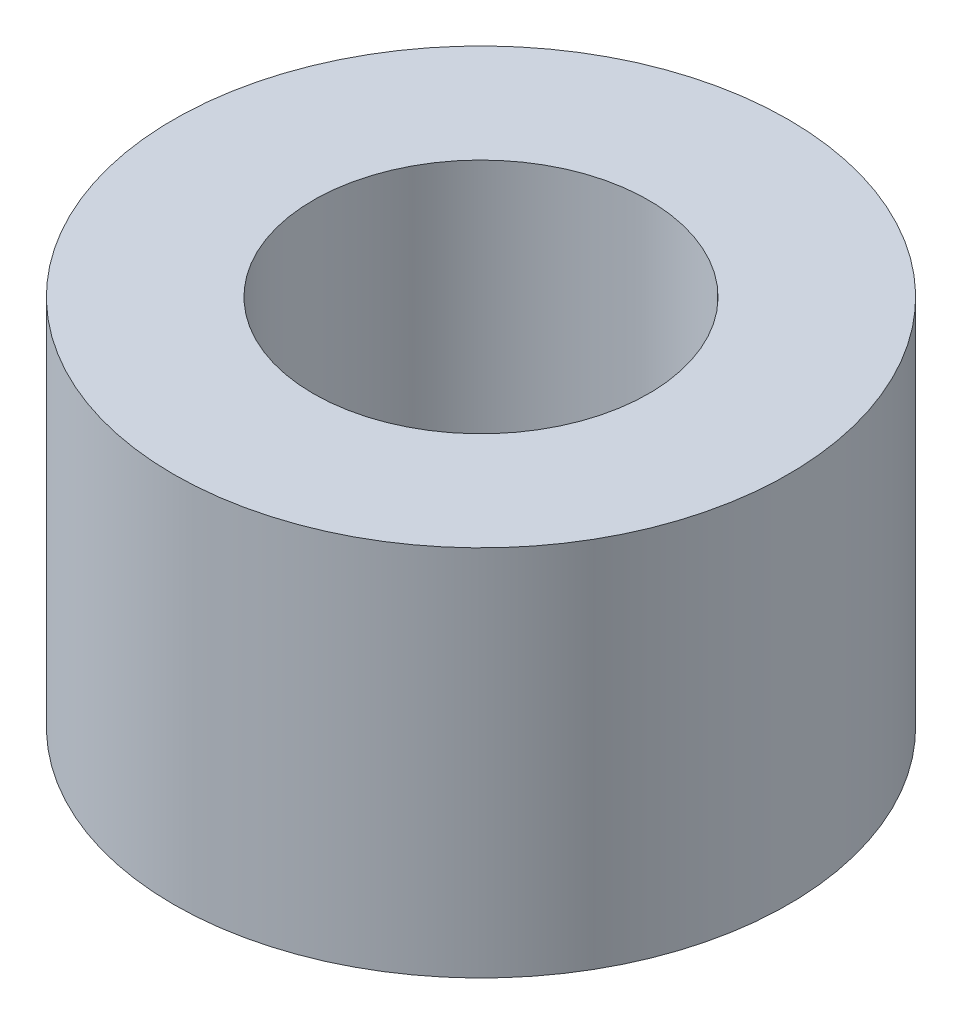
from build123d import *

# Parameters (mm, degrees)
SKETCH1_R           = 3.3
SKETCH1_R_2         = 1.8
BOSS_EXTRUDE1_DEPTH = 4


with BuildPart() as part:
    # Sketch1 → Boss-Extrude1 (new body)
    with BuildSketch(Plane(origin=(0, 0, 0), x_dir=(1, 0, 0), z_dir=(0, 1, 0))):
        with Locations(Location((0, 0, 0), (0, 0, 270))):
            Circle(SKETCH1_R)
        with Locations(Location((0, 0, 0), (0, 0, 270))):
            Circle(SKETCH1_R_2, mode=Mode.SUBTRACT)
    extrude(amount=BOSS_EXTRUDE1_DEPTH)


solid = part.part
